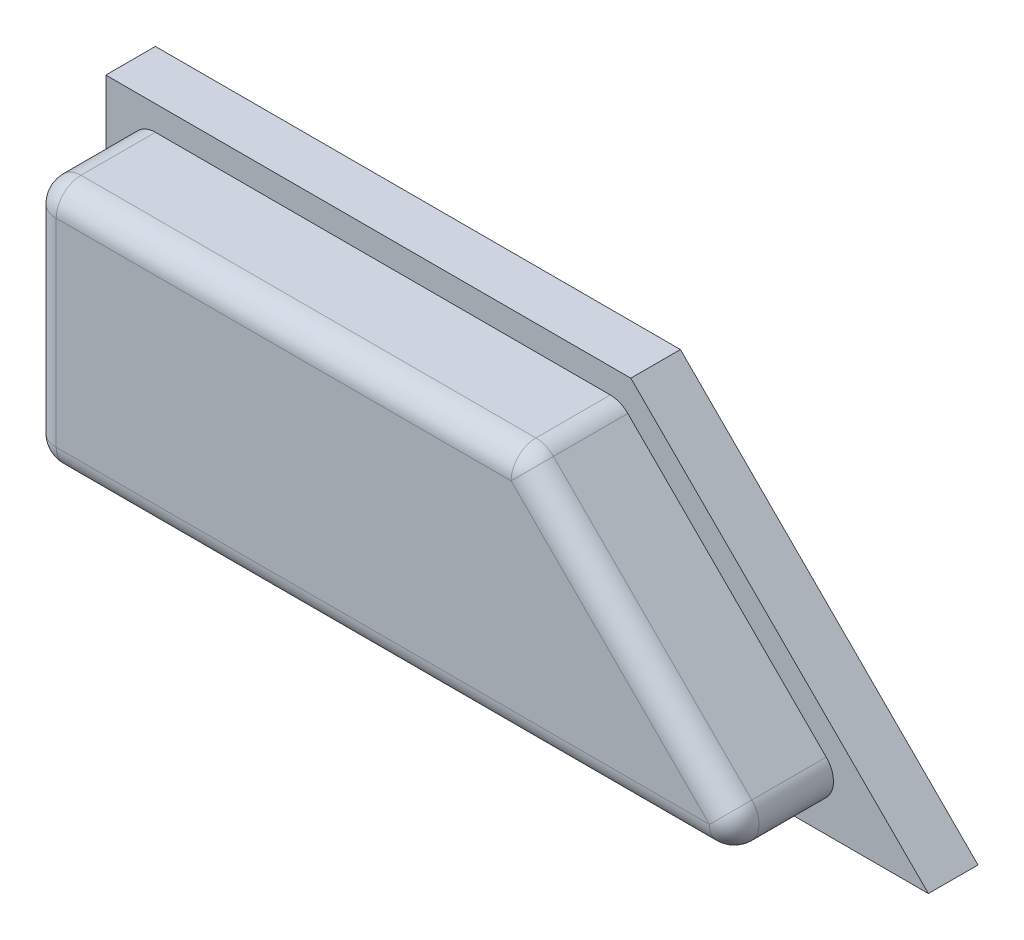
from build123d import *

# Parameters (mm, degrees)
BOSS_EXTRUDE3_DEPTH = 1
BOSS_EXTRUDE4_DEPTH = 2
FILLET1_R           = 0.5


with BuildPart() as part:
    # Sketch1 → Boss-Extrude3 (new body)
    with BuildSketch(Plane.XY):
        Polygon((-0.414213562, 7), (5.585786438, 1), (-0.414213562, 1), (-11, 1), (-11, 7), align=None)
    extrude(amount=BOSS_EXTRUDE3_DEPTH)

    # Sketch4 → Boss-Extrude4 (add)
    with BuildSketch(Plane.XY.offset(1)):
        Polygon((-0.621320344, 6.5), (4.378679656, 1.5), (-0.621320344, 1.5), (-10.5, 1.5), (-10.5, 6.5), align=None)
    extrude(amount=BOSS_EXTRUDE4_DEPTH)

    # Fillet1
    fillet1_edges = [part.edges().sort_by_distance(p)[0] for p in [
        (-10.5, 6.5, 2),
        (-10.5, 1.5, 2),
        (4.378679656, 1.5, 2),
        (-0.621320344, 6.5, 2),
        (-10.5, 4, 3),
        (-3.060660172, 1.5, 3),
        (1.878679656, 4, 3),
        (-5.560660172, 6.5, 3),
    ]]
    fillet(fillet1_edges, radius=FILLET1_R)


solid = part.part
